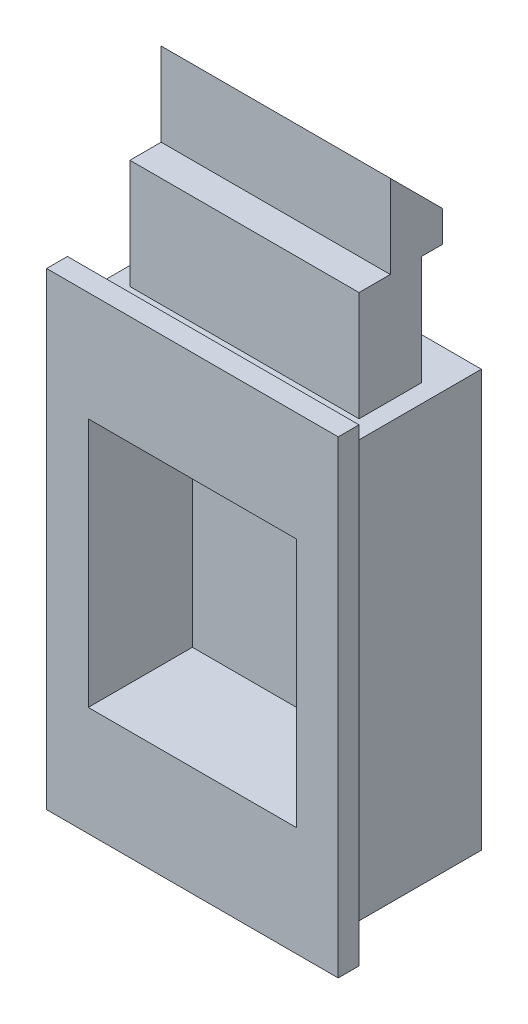
from build123d import *

# Parameters (mm, degrees)
SKETCH_1_W          = 28
SKETCH_1_H          = 45
EXTRUDE_1_DEPTH     = 2
SKETCH_2_W          = 25.5
SKETCH_2_H          = 40
EXTRUDE_2_DEPTH     = 13
EXTRUDE_3_DEPTH     = 11
SKETCH_4_W          = 20
SKETCH_4_H          = 24
CUT_EXTRUDE_1_DEPTH = 10


with BuildPart() as part:
    # 草图1 → 凸台-拉伸1 (new body)
    with BuildSketch(Plane.XY):
        Rectangle(SKETCH_1_W, SKETCH_1_H)
    extrude(amount=EXTRUDE_1_DEPTH)

    # 草图2 → 凸台-拉伸2 (add)
    with BuildSketch(Plane(origin=(0, 0, 0), x_dir=(-1, 0, 0), z_dir=(0, 0, -1))):
        Rectangle(SKETCH_2_W, SKETCH_2_H)
    extrude(amount=EXTRUDE_2_DEPTH)

    # 草图3 → 凸台-拉伸3 (add, symmetric)
    with BuildSketch(Plane(origin=(0, 0, 0), x_dir=(0, 0, -1), z_dir=(1, 0, 0))):
        Polygon((3, 20), (9, 20), (9, 30.5), (11, 30.5), (11, 33.5), (6, 38.5), (6, 30.5), (3, 30.5), align=None)
    extrude(amount=EXTRUDE_3_DEPTH, both=True)

    # 草图4 → 切除-拉伸1 (cut)
    with BuildSketch(Plane.XY.offset(2)):
        Rectangle(SKETCH_4_W, SKETCH_4_H)
    extrude(amount=-CUT_EXTRUDE_1_DEPTH, mode=Mode.SUBTRACT)


solid = part.part
